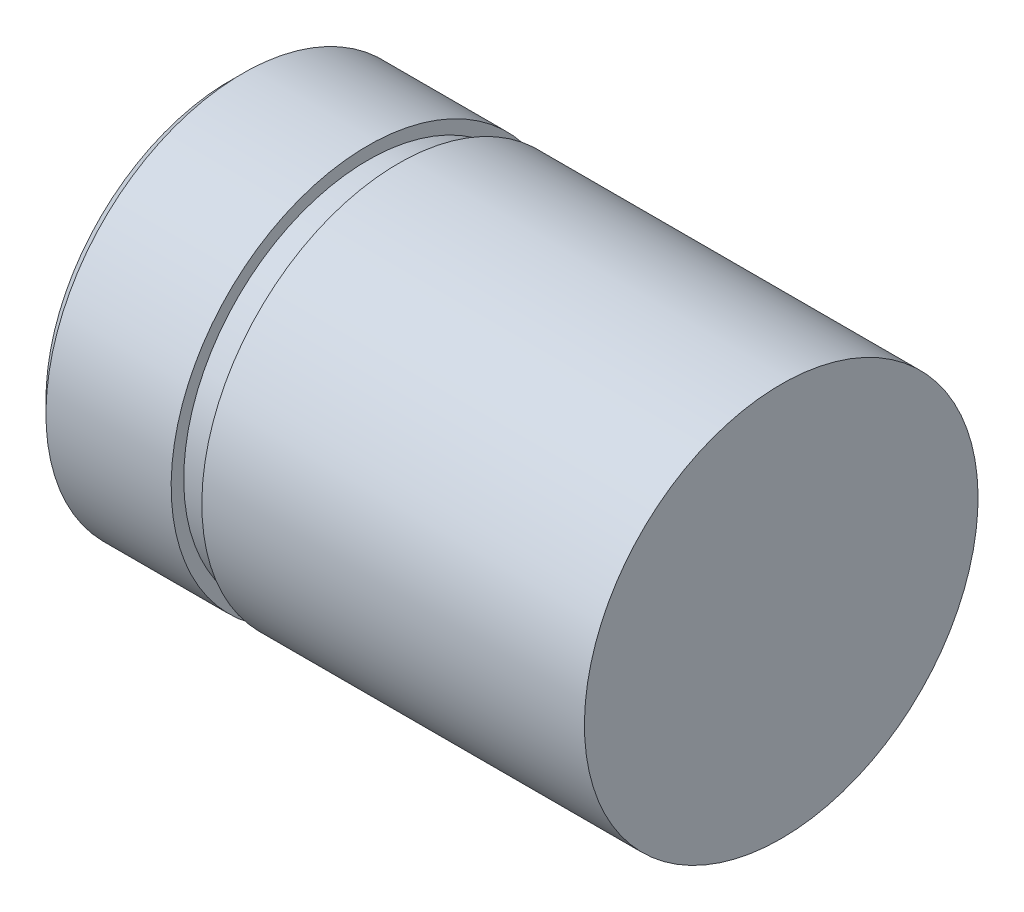
from build123d import *


with BuildPart() as part:
    # Sketch2 → Revolve1 (revolve)
    with BuildSketch(Plane.XY):
        Polygon((-4.9403, 0), (12.8397, 0), (12.8397, -6.35), (0.4953, -6.35), (0.4953, -5.9436), (-0.4953, -5.9436), (-0.4953, -6.35), (-4.5339, -6.35), (-4.9403, -5.9436), align=None)
    revolve(axis=Axis((12.8397, 0, 0), (1, 0, 0)))


solid = part.part
